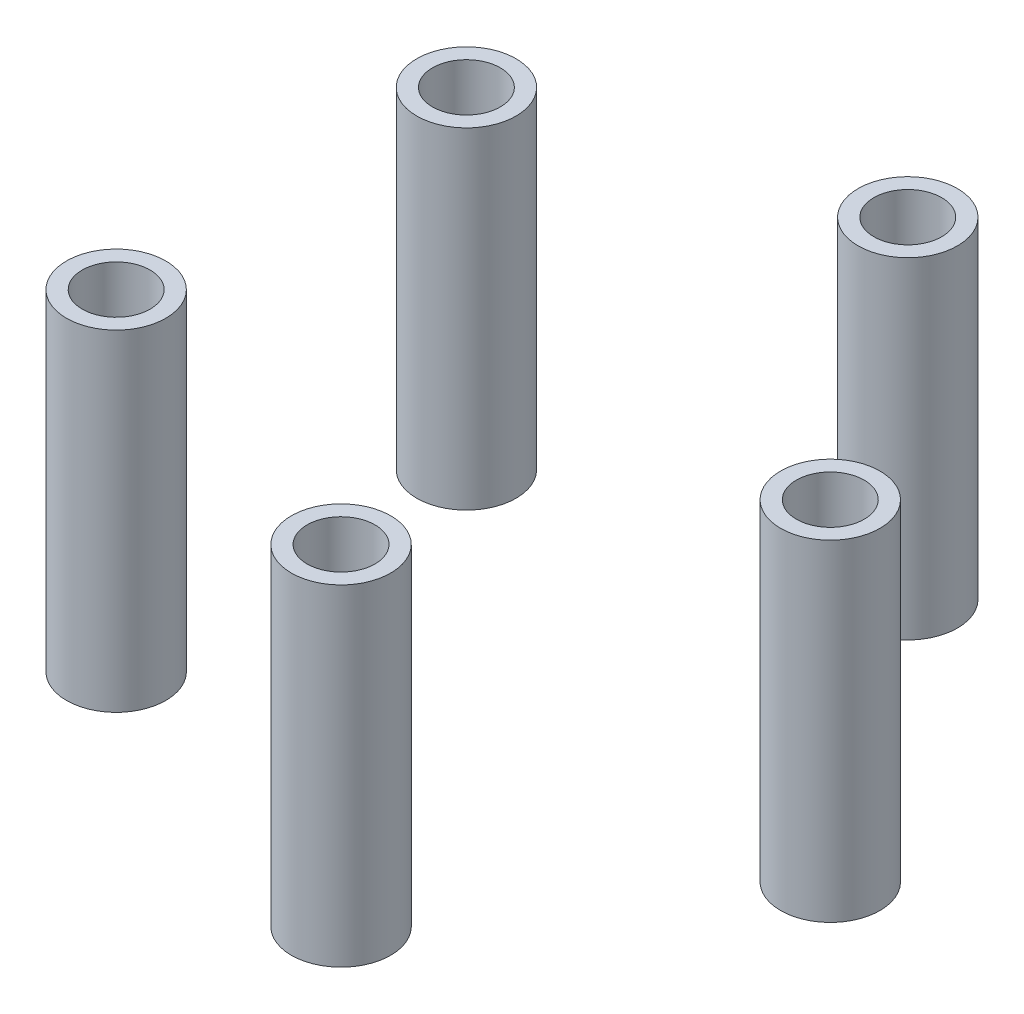
from build123d import *

# Parameters (mm, degrees)
BOSS_EXTRUDE1_DEPTH        = 12
BOSS_EXTRUDE1_DEPTH_BACK   = 8
SKETCH1_R                  = 3
SKETCH1_R_2                = 2.05
BOSS_EXTRUDE1_2_DEPTH      = 12
BOSS_EXTRUDE1_2_DEPTH_BACK = 8
BOSS_EXTRUDE1_3_DEPTH      = 12
BOSS_EXTRUDE1_3_DEPTH_BACK = 8
BOSS_EXTRUDE1_4_DEPTH      = 12
BOSS_EXTRUDE1_4_DEPTH_BACK = 8
BOSS_EXTRUDE1_5_DEPTH      = 12
BOSS_EXTRUDE1_5_DEPTH_BACK = 8


with BuildPart() as part:
    # Sketch1 → Boss-Extrude1 (new, two sides: drawn at the far end of the back side and taken through both)
    with BuildSketch(Plane(origin=(0, 0, 0), x_dir=(1, 0, 0), z_dir=(0, 1, 0)).offset(-BOSS_EXTRUDE1_DEPTH_BACK)):
        with Locations(Location((-15.762305899, -10.580134541, 0), (0, 0, 270))):
            Circle(SKETCH1_R)
        with Locations(Location((-15.762305899, -10.580134541, 0), (0, 0, 270))):
            Circle(SKETCH1_R_2, mode=Mode.SUBTRACT)
    extrude(amount=BOSS_EXTRUDE1_DEPTH + BOSS_EXTRUDE1_DEPTH_BACK)


with BuildPart() as body_2:
    # Sketch1 → Boss-Extrude1 2 (new, two sides: drawn at the far end of the back side and taken through both)
    with BuildSketch(Plane(origin=(0, 0, 0), x_dir=(1, 0, 0), z_dir=(0, 1, 0)).offset(-BOSS_EXTRUDE1_2_DEPTH_BACK)):
        with Locations(Location((4.362305899, -17.119017293, 0), (0, 0, 270))):
            Circle(SKETCH1_R)
        with Locations(Location((4.362305899, -17.119017293, 0), (0, 0, 270))):
            Circle(SKETCH1_R_2, mode=Mode.SUBTRACT)
    extrude(amount=BOSS_EXTRUDE1_2_DEPTH + BOSS_EXTRUDE1_2_DEPTH_BACK)


with BuildPart() as body_3:
    # Sketch1 → Boss-Extrude1 3 (new, two sides: drawn at the far end of the back side and taken through both)
    with BuildSketch(Plane(origin=(0, 0, 0), x_dir=(1, 0, 0), z_dir=(0, 1, 0)).offset(-BOSS_EXTRUDE1_3_DEPTH_BACK)):
        with Locations(Location((16.8, 0, 0), (0, 0, 270))):
            Circle(SKETCH1_R)
        with Locations(Location((16.8, 0, 0), (0, 0, 270))):
            Circle(SKETCH1_R_2, mode=Mode.SUBTRACT)
    extrude(amount=BOSS_EXTRUDE1_3_DEPTH + BOSS_EXTRUDE1_3_DEPTH_BACK)


with BuildPart() as body_4:
    # Sketch1 → Boss-Extrude1 4 (new, two sides: drawn at the far end of the back side and taken through both)
    with BuildSketch(Plane(origin=(0, 0, 0), x_dir=(1, 0, 0), z_dir=(0, 1, 0)).offset(-BOSS_EXTRUDE1_4_DEPTH_BACK)):
        with Locations(Location((-15.762305899, 10.580134541, 0), (0, 0, 270))):
            Circle(SKETCH1_R)
        with Locations(Location((-15.762305899, 10.580134541, 0), (0, 0, 270))):
            Circle(SKETCH1_R_2, mode=Mode.SUBTRACT)
    extrude(amount=BOSS_EXTRUDE1_4_DEPTH + BOSS_EXTRUDE1_4_DEPTH_BACK)


with BuildPart() as body_5:
    # Sketch1 → Boss-Extrude1 5 (new, two sides: drawn at the far end of the back side and taken through both)
    with BuildSketch(Plane(origin=(0, 0, 0), x_dir=(1, 0, 0), z_dir=(0, 1, 0)).offset(-BOSS_EXTRUDE1_5_DEPTH_BACK)):
        with Locations(Location((4.362305899, 17.119017293, 0), (0, 0, 270))):
            Circle(SKETCH1_R)
        with Locations(Location((4.362305899, 17.119017293, 0), (0, 0, 270))):
            Circle(SKETCH1_R_2, mode=Mode.SUBTRACT)
    extrude(amount=BOSS_EXTRUDE1_5_DEPTH + BOSS_EXTRUDE1_5_DEPTH_BACK)


solid = Compound([part.part, body_2.part, body_3.part, body_4.part, body_5.part])
